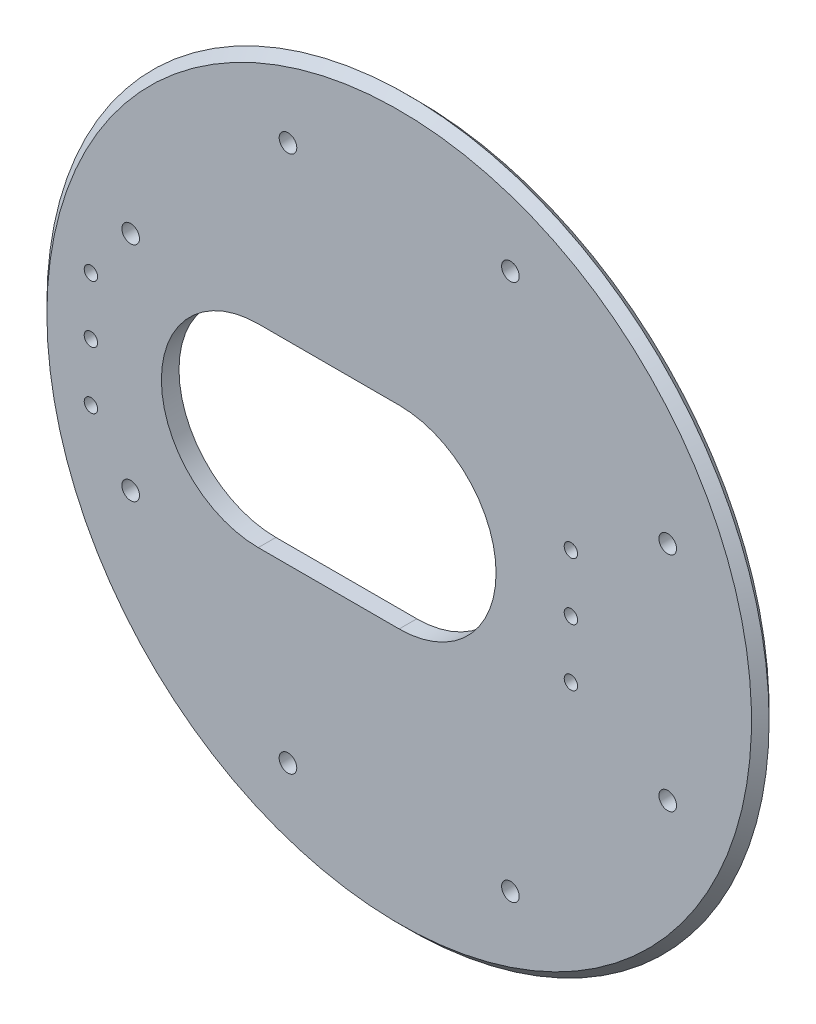
from build123d import *
from OCP.BRepFilletAPI import BRepFilletAPI_MakeChamfer

# Parameters (mm, degrees)
SKETCH1_R           = 152.4
BOSS_EXTRUDE1_DEPTH = 6.35
SKETCH2_R           = 2.413
CUT_EXTRUDE1_DEPTH  = 10.16
SKETCH4_R           = 2.413
CUT_EXTRUDE2_DEPTH  = 7.62
CHAMFER1_SIZE       = 2.54
CHAMFER1_SIZE2      = 2.207988314
SKETCH6_R           = 152.4
SKETCH6_R_2         = 127
CUT_EXTRUDE3_DEPTH  = 7.62
SKETCH7_R           = 3.175
CUT_EXTRUDE4_DEPTH  = 15.24


with BuildPart() as part:
    # Sketch1 → Boss-Extrude1 (new body)
    with BuildSketch(Plane.XY):
        Circle(SKETCH1_R)
        with BuildLine():
            ThreePointArc((-5e-08, 34.925), (34.925, -5.6e-08), (-1.61e-07, -34.925))
            Line((-1.61e-07, -34.925), (-50.8, -34.925))
            ThreePointArc((-50.8, -34.925), (-85.725, 0), (-50.8, 34.925))
            Line((-50.8, 34.925), (-5e-08, 34.925))
        make_face(mode=Mode.SUBTRACT)
    extrude(amount=BOSS_EXTRUDE1_DEPTH)

    # Sketch2 → Cut-Extrude1 (cut)
    with BuildSketch(Plane(origin=(0, 0, 0), x_dir=(-1, 0, 0), z_dir=(0, 0, -1))):
        with Locations((111.125, 20.6375)):
            Circle(SKETCH2_R)
        with Locations((111.125, 0)):
            Circle(SKETCH2_R)
        with Locations((111.125, -20.6375)):
            Circle(SKETCH2_R)
    extrude(amount=-CUT_EXTRUDE1_DEPTH, mode=Mode.SUBTRACT)

    # Sketch4 → Cut-Extrude2 (cut)
    with BuildSketch(Plane.XY.offset(6.35)):
        with Locations((61.8998, 20.6375)):
            Circle(SKETCH4_R)
        with Locations((61.8998, 0)):
            Circle(SKETCH4_R)
        with Locations((61.8998, -20.6375)):
            Circle(SKETCH4_R)
    extrude(amount=-CUT_EXTRUDE2_DEPTH, mode=Mode.SUBTRACT)

    # Chamfer1: one chamfer whose edges measure the first distance from different faces: ONE call of the kernel's chamfer builder (chamfer() names one face for all edges)
    chamfer1_edges_1 = [part.edges().sort_by_distance(p)[0] for p in [
        (-108.712, 20.6375, 0),
        (-108.712, 0, 0),
        (-108.712, -20.6375, 0),
    ]]
    chamfer1_side_1 = [part.faces().sort_by_distance(p)[0] for p in [
        (-148.089477062, 0, 0),
    ]]
    chamfer1_edges_2 = [part.edges().sort_by_distance(p)[0] for p in [
        (59.4868, 20.6375, 0),
    ]]
    chamfer1_side_2 = [part.faces().sort_by_distance(p)[0] for p in [
        (59.4868, 20.6375, 3.175),
    ]]
    chamfer1_edges_3 = [part.edges().sort_by_distance(p)[0] for p in [
        (59.4868, 0, 0),
    ]]
    chamfer1_side_3 = [part.faces().sort_by_distance(p)[0] for p in [
        (59.4868, 0, 3.175),
    ]]
    chamfer1_edges_4 = [part.edges().sort_by_distance(p)[0] for p in [
        (59.4868, -20.6375, 0),
    ]]
    chamfer1_side_4 = [part.faces().sort_by_distance(p)[0] for p in [
        (59.4868, -20.6375, 3.175),
    ]]
    chamfer1 = BRepFilletAPI_MakeChamfer(part.part.solid().wrapped)
    for e in chamfer1_edges_1:
        chamfer1.Add(CHAMFER1_SIZE, CHAMFER1_SIZE2, e.wrapped, chamfer1_side_1[0].wrapped)  # the first distance lies on this face
    for e in chamfer1_edges_2:
        chamfer1.Add(CHAMFER1_SIZE, CHAMFER1_SIZE2, e.wrapped, chamfer1_side_2[0].wrapped)  # the first distance lies on this face
    for e in chamfer1_edges_3:
        chamfer1.Add(CHAMFER1_SIZE, CHAMFER1_SIZE2, e.wrapped, chamfer1_side_3[0].wrapped)  # the first distance lies on this face
    for e in chamfer1_edges_4:
        chamfer1.Add(CHAMFER1_SIZE, CHAMFER1_SIZE2, e.wrapped, chamfer1_side_4[0].wrapped)  # the first distance lies on this face
    add(Compound.cast(chamfer1.Shape()), mode=Mode.REPLACE)

    # Sketch6 → Cut-Extrude3 (cut)
    with BuildSketch(Plane(origin=(0, 0, 0), x_dir=(-1, 0, 0), z_dir=(0, 0, -1))):
        Circle(SKETCH6_R)
        Circle(SKETCH6_R_2, mode=Mode.SUBTRACT)
    extrude(amount=-CUT_EXTRUDE3_DEPTH, mode=Mode.SUBTRACT)

    # Sketch5 → Revolve1 (revolve)
    with BuildSketch(Plane(origin=(0, 0, 0), x_dir=(1, 0, 0), z_dir=(0, 1, 0))):
        Polygon((-127, -6.35), (-127, 0), (-130.175, -3.175), align=None)
    revolve(axis=Axis((0, 0, 0), (0, 0, 1)))

    # Sketch7 → Cut-Extrude4 (cut)
    with BuildSketch(Plane(origin=(0, 0, 0), x_dir=(-1, 0, 0), z_dir=(0, 0, -1))):
        with Locations((40.095656626, 96.799478019)):
            Circle(SKETCH7_R)
        with Locations((96.799478019, 40.095656626)):
            Circle(SKETCH7_R)
        with Locations((96.799478019, -40.095656626)):
            Circle(SKETCH7_R)
        with Locations((40.095656626, -96.799478019)):
            Circle(SKETCH7_R)
        with Locations((-40.095656626, -96.799478019)):
            Circle(SKETCH7_R)
        with Locations((-96.799478019, -40.095656626)):
            Circle(SKETCH7_R)
        with Locations((-96.799478019, 40.095656626)):
            Circle(SKETCH7_R)
        with Locations((-40.095656626, 96.799478019)):
            Circle(SKETCH7_R)
    extrude(amount=-CUT_EXTRUDE4_DEPTH, mode=Mode.SUBTRACT)


solid = part.part
